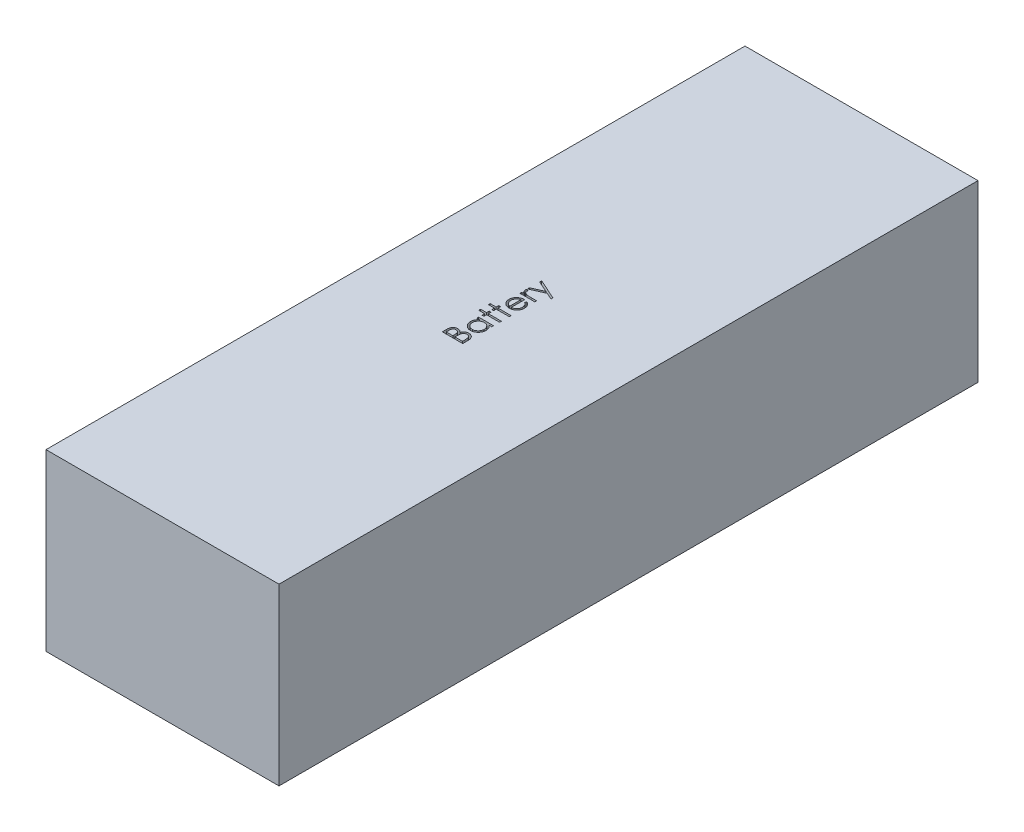
from build123d import *

# Parameters (mm, degrees)
SKETCH1_W           = 40
SKETCH1_H           = 120
BOSS_EXTRUDE1_DEPTH = 30
CUT_EXTRUDE1_DEPTH  = 2


with BuildPart() as part:
    # Sketch1 → Boss-Extrude1 (new body)
    with BuildSketch(Plane(origin=(0, 0, 0), x_dir=(1, 0, 0), z_dir=(0, 1, 0))):
        Rectangle(SKETCH1_W, SKETCH1_H)
    extrude(amount=BOSS_EXTRUDE1_DEPTH)

    # Sketch2 → Cut-Extrude1 (cut)
    # profile 1 of 7: a face of its own
    with BuildSketch(Plane(origin=(0, 30, 0), x_dir=(1, 0, 0), z_dir=(0, 1, 0))):
        with BuildLine():
            Line((-3.5, -8.458333333), (-3.5, -7.775440705))
            add(Edge.make_bspline(
                [(-3.5, -7.775440705), (-3.499827016, -7.7420117), (-3.499491731, -7.677217968), (-3.494170998, -7.58300569), (-3.487097587, -7.49473206), (-3.47523232, -7.412553068), (-3.462929603, -7.335933987), (-3.44487216, -7.265652662), (-3.424927056, -7.201120399), (-3.394238808, -7.12363036), (-3.346579571, -7.035707293), (-3.275896393, -6.941206448), (-3.191152971, -6.859060546), (-3.094581157, -6.789212181), (-2.988341218, -6.733157382), (-2.874718941, -6.693117247), (-2.755625884, -6.66739394), (-2.673976582, -6.664781715), (-2.63271234, -6.663461538)],
                knots=[0, 0, 0, 0, 1.00128172, 1.940733171, 2.826250472, 3.653024905, 4.427672124, 5.149348099, 5.824709082, 6.450061444, 7.643590664, 8.808605388, 9.972104426, 11.165284501, 12.367876273, 13.557044126, 14.765369432, 16, 16, 16, 16], degree=3))
            add(Edge.make_bspline(
                [(-2.63271234, -6.663461538), (-2.594061484, -6.664561149), (-2.518108906, -6.666721988), (-2.407211066, -6.687132958), (-2.301753702, -6.719528085), (-2.201827071, -6.764299458), (-2.109291316, -6.821984866), (-2.024433087, -6.891100094), (-1.950459558, -6.974141487), (-1.909119745, -7.036389596), (-1.888120994, -7.068008814)],
                knots=[0, 0, 0, 0, 1.044641374, 2.052818814, 3.038628718, 4.023282556, 5.005660861, 5.98021751, 6.974042014, 8, 8, 8, 8], degree=3))
            add(Edge.make_bspline(
                [(-1.888120994, -7.068008814), (-1.872851052, -7.028252226), (-1.84363587, -6.952188024), (-1.792064534, -6.847452202), (-1.73576949, -6.757544715), (-1.675242264, -6.680709266), (-1.609038135, -6.615342188), (-1.536619226, -6.558730519), (-1.458044822, -6.509788628), (-1.37360371, -6.468139417), (-1.284011735, -6.435423443), (-1.190363175, -6.411377655), (-1.093017032, -6.397154049), (-1.026955989, -6.395213731), (-0.993489583, -6.394230769)],
                knots=[0, 0, 0, 0, 1.272586185, 2.434772614, 3.483318042, 4.437947805, 5.351807173, 6.25737843, 7.180033415, 8.1141739, 9.066731021, 10.025721652, 10.999834114, 12, 12, 12, 12], degree=3))
            add(Edge.make_bspline(
                [(-0.993489583, -6.394230769), (-0.959322572, -6.395207402), (-0.89209802, -6.397128954), (-0.793344872, -6.411311975), (-0.698962627, -6.435309874), (-0.608384297, -6.468422258), (-0.521799795, -6.511341419), (-0.439522785, -6.564327526), (-0.361382093, -6.62663676), (-0.28723981, -6.697056266), (-0.21939729, -6.775533297), (-0.161075602, -6.862020036), (-0.110927262, -6.954147167), (-0.070098271, -7.053092449), (-0.038598733, -7.158603294), (-0.016652218, -7.270620992), (-0.001839877, -7.388961064), (-0.000623699, -7.47017141), (0, -7.51181891)],
                knots=[0, 0, 0, 0, 0.978680899, 1.925582087, 2.851223405, 3.764209995, 4.683484765, 5.614004905, 6.562443559, 7.542772147, 8.539900013, 9.527881485, 10.525548727, 11.540192123, 12.58875426, 13.674701727, 14.807505862, 16, 16, 16, 16], degree=3))
            Line((0, -7.51181891), (0, -8.458333333))
            Line((0, -8.458333333), (-3.5, -8.458333333))
        make_face()
        with BuildLine():
            Line((-3.141025641, -8.144230769), (-2.019230769, -8.144230769))
            Line((-2.019230769, -8.144230769), (-2.019230769, -7.933193109))
            add(Edge.make_bspline(
                [(-2.019230769, -7.933193109), (-2.019630692, -7.902344314), (-2.020403425, -7.842738154), (-2.022616943, -7.756418259), (-2.028814983, -7.676293237), (-2.035011254, -7.602501414), (-2.045085813, -7.535158937), (-2.05707803, -7.474415185), (-2.069760632, -7.419316235), (-2.091331398, -7.355778177), (-2.123200398, -7.283695136), (-2.172706503, -7.206901904), (-2.231625018, -7.138888088), (-2.300244736, -7.082142986), (-2.374983675, -7.035291432), (-2.455185698, -7.002470444), (-2.539236842, -6.980589669), (-2.597049479, -6.978582956), (-2.626402244, -6.977564103)],
                knots=[0, 0, 0, 0, 1.156917035, 2.235399477, 3.236897345, 4.169954739, 5.01148057, 5.788325709, 6.491867502, 7.129259015, 8.302032419, 9.437271567, 10.542795419, 11.662606952, 12.764338259, 13.836858145, 14.901724648, 16, 16, 16, 16], degree=3))
            add(Edge.make_bspline(
                [(-2.626402244, -6.977564103), (-2.645830562, -6.978081414), (-2.683941329, -6.979096176), (-2.739678522, -6.987708999), (-2.79205104, -7.001664059), (-2.841561526, -7.020562972), (-2.886979527, -7.046381692), (-2.930475233, -7.076308981), (-2.969443462, -7.113258467), (-3.005760298, -7.155014668), (-3.038263745, -7.202791209), (-3.065187813, -7.257617437), (-3.089589964, -7.31807601), (-3.107654151, -7.385807203), (-3.123538771, -7.459407601), (-3.133519185, -7.539873783), (-3.139941675, -7.626695849), (-3.14065626, -7.686852637), (-3.141025641, -7.717948718)],
                knots=[0, 0, 0, 0, 0.911708768, 1.788416306, 2.640049961, 3.452993646, 4.268229297, 5.087074648, 5.92553149, 6.781184137, 7.681934069, 8.628939405, 9.643570426, 10.73771997, 11.914765019, 13.176320755, 14.540391495, 16, 16, 16, 16], degree=3))
            Line((-3.141025641, -7.717948718), (-3.141025641, -8.144230769))
        make_face(mode=Mode.SUBTRACT)
        with BuildLine():
            Line((-1.66025641, -8.144230769), (-0.358974359, -8.144230769))
            Line((-0.358974359, -8.144230769), (-0.358974359, -7.696915064))
            add(Edge.make_bspline(
                [(-0.358974359, -7.696915064), (-0.359396264, -7.664899487), (-0.36020943, -7.603193683), (-0.362116473, -7.514030942), (-0.369330527, -7.431606517), (-0.375985459, -7.355660387), (-0.387365108, -7.286394114), (-0.398104538, -7.223274898), (-0.414046454, -7.167338884), (-0.435956742, -7.101880807), (-0.471032393, -7.028713806), (-0.522277589, -6.948755445), (-0.585522071, -6.879032992), (-0.657450692, -6.819182776), (-0.735443268, -6.769791778), (-0.818480193, -6.734349065), (-0.904946557, -6.712323699), (-0.963915826, -6.709666133), (-0.993489583, -6.708333333)],
                knots=[0, 0, 0, 0, 1.160376723, 2.23647316, 3.230273494, 4.158083346, 4.997711197, 5.773399541, 6.476071462, 7.102777513, 8.27340052, 9.405620712, 10.53304798, 11.669441455, 12.787990954, 13.865552736, 14.929550474, 16, 16, 16, 16], degree=3))
            add(Edge.make_bspline(
                [(-0.993489583, -6.708333333), (-1.011983322, -6.708608592), (-1.048672494, -6.70915467), (-1.102582506, -6.717427612), (-1.154829834, -6.729395938), (-1.205632199, -6.745158567), (-1.254135426, -6.767193873), (-1.300525527, -6.794207311), (-1.345737015, -6.82512899), (-1.403634242, -6.872835293), (-1.469513255, -6.943237626), (-1.533216158, -7.043287197), (-1.58542007, -7.156418988), (-1.60748965, -7.238664126), (-1.618890224, -7.28114984)],
                knots=[0, 0, 0, 0, 0.723302347, 1.434937762, 2.129609326, 2.821140842, 3.513216847, 4.209993937, 4.920569932, 5.655069131, 7.14393391, 8.6716197, 10.280644748, 12, 12, 12, 12], degree=3))
            add(Edge.make_bspline(
                [(-1.618890224, -7.28114984), (-1.622345308, -7.298178936), (-1.629836643, -7.335101528), (-1.637744346, -7.395309108), (-1.644789406, -7.464044977), (-1.650000564, -7.541467855), (-1.655387107, -7.627675696), (-1.657481929, -7.722852614), (-1.659981189, -7.826609929), (-1.660162323, -7.898602301), (-1.66025641, -7.935997596)],
                knots=[0, 0, 0, 0, 0.634451884, 1.375622551, 2.216452059, 3.157844607, 4.20941857, 5.370758133, 6.634282058, 8, 8, 8, 8], degree=3))
            Line((-1.66025641, -7.935997596), (-1.66025641, -8.144230769))
        make_face(mode=Mode.SUBTRACT)
    # profile 2 of 7: a face of its own
    with BuildSketch(Plane(origin=(0, 30, 0), x_dir=(1, 0, 0), z_dir=(0, 1, 0))):
        with BuildLine():
            Line((-2.557692308, -3.163461538), (0, -3.163461538))
            Line((0, -3.163461538), (0, -3.477564103))
            Line((0, -3.477564103), (-0.442407853, -3.477564103))
            add(Edge.make_bspline(
                [(-0.442407853, -3.477564103), (-0.402434233, -3.513038188), (-0.324309204, -3.582369261), (-0.22130842, -3.697074077), (-0.137906052, -3.820172648), (-0.069567916, -3.948576069), (-0.018442034, -4.083542085), (0.017961997, -4.22436527), (0.041350966, -4.371180164), (0.043687656, -4.471432036), (0.044871795, -4.522235577)],
                knots=[0, 0, 0, 0, 1.074325654, 2.099677833, 3.090439787, 4.057542011, 5.018572219, 5.985274637, 6.979019747, 8, 8, 8, 8], degree=3))
            add(Edge.make_bspline(
                [(0.044871795, -4.522235577), (0.043645423, -4.567403531), (0.041226962, -4.656476736), (0.022464659, -4.787505813), (-0.007665963, -4.913598062), (-0.049566853, -5.034872635), (-0.105147674, -5.15054478), (-0.171688922, -5.261604877), (-0.250929752, -5.367477569), (-0.341517781, -5.466549108), (-0.439912768, -5.557781108), (-0.544858315, -5.637842381), (-0.655900619, -5.704595461), (-0.771633773, -5.760415542), (-0.892948692, -5.803411886), (-1.01942586, -5.83338552), (-1.150915734, -5.852125967), (-1.240455257, -5.854543428), (-1.285857372, -5.855769231)],
                knots=[0, 0, 0, 0, 1.033919861, 2.038935746, 3.024066025, 3.998881131, 4.97069526, 5.957263378, 6.95902576, 7.993208707, 9.027059324, 10.027763471, 11.009749337, 11.988697705, 12.965288445, 13.950418724, 14.960734635, 16, 16, 16, 16], degree=3))
            add(Edge.make_bspline(
                [(-1.285857372, -5.855769231), (-1.330321075, -5.854516259), (-1.418223419, -5.852039203), (-1.547502117, -5.833585983), (-1.672020377, -5.802554974), (-1.791377321, -5.759007126), (-1.905717371, -5.703165171), (-2.015121396, -5.635237084), (-2.119890793, -5.55521796), (-2.21756202, -5.462965553), (-2.307782634, -5.363030783), (-2.38619168, -5.256122052), (-2.453908529, -5.14489877), (-2.507562005, -5.02763576), (-2.550971109, -4.906068655), (-2.581004078, -4.779115209), (-2.598701399, -4.647303631), (-2.601264163, -4.557813138), (-2.602564103, -4.512419872)],
                knots=[0, 0, 0, 0, 1.020392517, 2.01726096, 2.990465484, 3.961182959, 4.928053699, 5.906110375, 6.912531644, 7.948652711, 8.985773172, 9.998621852, 10.987621588, 11.969261332, 12.953316658, 13.946091881, 14.958173133, 16, 16, 16, 16], degree=3))
            add(Edge.make_bspline(
                [(-2.602564103, -4.512419872), (-2.60112475, -4.460221001), (-2.598302246, -4.35786148), (-2.574862161, -4.208119493), (-2.535141118, -4.066525993), (-2.481482841, -3.931577829), (-2.408686533, -3.805132528), (-2.319426341, -3.685616034), (-2.210011935, -3.575571068), (-2.127018146, -3.510798221), (-2.084435096, -3.477564103)],
                knots=[0, 0, 0, 0, 1.039007978, 2.037445607, 3.008437381, 3.96246474, 4.921201921, 5.904967172, 6.925065498, 8, 8, 8, 8], degree=3))
            Line((-2.084435096, -3.477564103), (-2.557692308, -3.477564103))
            Line((-2.557692308, -3.477564103), (-2.557692308, -3.163461538))
        make_face()
        with BuildLine():
            add(Edge.make_bspline(
                [(-2.288461538, -4.508213141), (-2.286826503, -4.554126491), (-2.283599202, -4.64475214), (-2.258445926, -4.777810432), (-2.216485352, -4.905070149), (-2.159435035, -5.026333401), (-2.086337296, -5.138218684), (-2.000214663, -5.239968121), (-1.899613419, -5.328444379), (-1.788133794, -5.404533748), (-1.667961498, -5.465616495), (-1.542380577, -5.508840764), (-1.413564365, -5.537295235), (-1.326203179, -5.540205729), (-1.282351763, -5.541666667)],
                knots=[0, 0, 0, 0, 1.031130969, 2.035288524, 3.029955243, 4.035265425, 5.037320146, 6.024362013, 7.021230137, 8.037832003, 9.049975902, 10.039737725, 11.016035826, 12, 12, 12, 12], degree=3))
            add(Edge.make_bspline(
                [(-1.282351763, -5.541666667), (-1.238764409, -5.539794247), (-1.151760548, -5.536056748), (-1.022955393, -5.509463754), (-0.897656365, -5.46426423), (-0.776518381, -5.40326408), (-0.663949475, -5.326279197), (-0.561541317, -5.237887085), (-0.474071536, -5.135648106), (-0.400797577, -5.022762497), (-0.341644806, -4.902143299), (-0.300476607, -4.775312314), (-0.273899498, -4.644635904), (-0.27079493, -4.555783674), (-0.269230769, -4.511017628)],
                knots=[0, 0, 0, 0, 0.979154007, 1.954470061, 2.941101473, 3.965068436, 4.993389179, 5.998216918, 6.996159742, 8.005560442, 9.015493761, 10.005250788, 10.994993882, 12, 12, 12, 12], degree=3))
            add(Edge.make_bspline(
                [(-0.269230769, -4.511017628), (-0.27090991, -4.465577318), (-0.274249554, -4.375201047), (-0.299260521, -4.24159942), (-0.342149827, -4.112389458), (-0.399788619, -3.988452577), (-0.471579217, -3.873107804), (-0.555626614, -3.769935177), (-0.652700961, -3.681663055), (-0.760626239, -3.608170055), (-0.878190217, -3.549886515), (-1.00322951, -3.507270335), (-1.135997919, -3.482353785), (-1.226858223, -3.479182739), (-1.273237179, -3.477564103)],
                knots=[0, 0, 0, 0, 1.01787422, 2.024450869, 3.03297362, 4.061474925, 5.080076323, 6.069755756, 7.033548292, 8.009625779, 8.9862229, 9.964937832, 10.961217871, 12, 12, 12, 12], degree=3))
            add(Edge.make_bspline(
                [(-1.273237179, -3.477564103), (-1.30857501, -3.478523759), (-1.378131043, -3.480412666), (-1.480258561, -3.494843236), (-1.577992287, -3.517798162), (-1.671434976, -3.550144332), (-1.760069991, -3.592635617), (-1.844533752, -3.643883383), (-1.924386963, -3.704788832), (-1.998530034, -3.774371528), (-2.066156496, -3.850536731), (-2.126520737, -3.931131272), (-2.17610951, -4.017110019), (-2.217150781, -4.107027056), (-2.249809931, -4.20103839), (-2.271597625, -4.29990901), (-2.286557946, -4.402587997), (-2.287820327, -4.472634052), (-2.288461538, -4.508213141)],
                knots=[0, 0, 0, 0, 1.050140795, 2.067009409, 3.05949893, 4.030605086, 5.00011959, 5.97591094, 6.962425594, 7.979863591, 8.993523472, 9.986985069, 10.967611495, 11.937549037, 12.921786183, 13.919465291, 14.943216303, 16, 16, 16, 16], degree=3))
        make_face(mode=Mode.SUBTRACT)
    # profile 3 of 7: a face of its own
    with BuildSketch(Plane(origin=(0, 30, 0), x_dir=(1, 0, 0), z_dir=(0, 1, 0))):
        Polygon((-3.58974359, -2.131410256), (-3.58974359, -1.817307692), (-2.557692308, -1.817307692), (-2.557692308, -1.368589744), (-2.243589744, -1.368589744), (-2.243589744, -1.817307692), (0, -1.817307692), (0, -2.131410256), (-2.243589744, -2.131410256), (-2.243589744, -2.580128205), (-2.557692308, -2.580128205), (-2.557692308, -2.131410256), align=None)
    # profile 4 of 7: a face of its own
    with BuildSketch(Plane(origin=(0, 30, 0), x_dir=(1, 0, 0), z_dir=(0, 1, 0))):
        Polygon((-3.58974359, -0.471153846), (-3.58974359, -0.157051282), (-2.557692308, -0.157051282), (-2.557692308, 0.291666667), (-2.243589744, 0.291666667), (-2.243589744, -0.157051282), (0, -0.157051282), (0, -0.471153846), (-2.243589744, -0.471153846), (-2.243589744, -0.919871795), (-2.557692308, -0.919871795), (-2.557692308, -0.471153846), align=None)
    # profile 5 of 7: a face of its own
    with BuildSketch(Plane(origin=(0, 30, 0), x_dir=(1, 0, 0), z_dir=(0, 1, 0))):
        with BuildLine():
            Line((-0.807692308, 2.974158654), (-0.661157853, 3.253205128))
            add(Edge.make_bspline(
                [(-0.661157853, 3.253205128), (-0.621723871, 3.230956867), (-0.54500096, 3.187670562), (-0.439586991, 3.113533639), (-0.345319457, 3.035105172), (-0.26370785, 2.949998894), (-0.191634668, 2.860779417), (-0.129467518, 2.765752187), (-0.07608468, 2.665692851), (-0.032342426, 2.559499307), (0.002045853, 2.447298764), (0.027441832, 2.328440154), (0.042169086, 2.202362272), (0.043956532, 2.116024309), (0.044871795, 2.071814904)],
                knots=[0, 0, 0, 0, 1.120611642, 2.180266485, 3.186550691, 4.152466804, 5.095166165, 6.022949561, 6.960161436, 7.899497276, 8.862391909, 9.862399089, 10.905440174, 12, 12, 12, 12], degree=3))
            add(Edge.make_bspline(
                [(0.044871795, 2.071814904), (0.04372462, 2.022672926), (0.041486813, 1.926811165), (0.022194349, 1.787271417), (-0.009278012, 1.655892002), (-0.053243547, 1.532680284), (-0.110670893, 1.417938085), (-0.180630295, 1.311437034), (-0.26276285, 1.21261825), (-0.357778154, 1.124591225), (-0.459464338, 1.045357789), (-0.565404947, 0.975394209), (-0.675233097, 0.91717448), (-0.788295336, 0.8690925), (-0.90433474, 0.83116493), (-1.024015882, 0.804213014), (-1.146864189, 0.788819865), (-1.229959798, 0.786450451), (-1.271834936, 0.78525641)],
                knots=[0, 0, 0, 0, 1.14524686, 2.234044844, 3.276713788, 4.290115724, 5.276966211, 6.260758605, 7.254862358, 8.264742877, 9.274005885, 10.257798278, 11.220590477, 12.167824544, 13.118936889, 14.062732937, 15.023735098, 16, 16, 16, 16], degree=3))
            add(Edge.make_bspline(
                [(-1.271834936, 0.78525641), (-1.311129766, 0.786315552), (-1.389006931, 0.78841463), (-1.504272476, 0.801645417), (-1.616300928, 0.82509371), (-1.725185376, 0.857270034), (-1.83074351, 0.89882128), (-1.933039574, 0.9496535), (-2.031964713, 1.009845877), (-2.094367847, 1.056318551), (-2.125801282, 1.079727564)],
                knots=[0, 0, 0, 0, 1.024358464, 2.0301432, 3.019427413, 4.004406732, 4.986367066, 5.972626655, 6.978780325, 8, 8, 8, 8], degree=3))
            add(Edge.make_bspline(
                [(-2.125801282, 1.079727564), (-2.163732941, 1.111380583), (-2.238272838, 1.17358226), (-2.335322662, 1.279879021), (-2.418340489, 1.393428801), (-2.486066597, 1.515373775), (-2.538158683, 1.645508534), (-2.575211094, 1.783161852), (-2.598266796, 1.9287142), (-2.601109889, 2.028491927), (-2.602564103, 2.079527244)],
                knots=[0, 0, 0, 0, 1.030811313, 2.025658015, 2.997072178, 3.962767568, 4.930766827, 5.917075773, 6.934604948, 8, 8, 8, 8], degree=3))
            add(Edge.make_bspline(
                [(-2.602564103, 2.079527244), (-2.601216835, 2.131977865), (-2.598573804, 2.234874027), (-2.573851652, 2.384863538), (-2.535122917, 2.527065444), (-2.478696987, 2.660306226), (-2.408753193, 2.786638927), (-2.320347513, 2.903156015), (-2.218020567, 3.01305596), (-2.13924476, 3.076957845), (-2.099158654, 3.10947516)],
                knots=[0, 0, 0, 0, 1.056389096, 2.072394598, 3.055233004, 4.020130009, 4.981825462, 5.957811105, 6.960805292, 8, 8, 8, 8], degree=3))
            add(Edge.make_bspline(
                [(-2.099158654, 3.10947516), (-2.068955072, 3.131602099), (-2.008748954, 3.175708692), (-1.910577797, 3.230955792), (-1.807867202, 3.278913187), (-1.698956905, 3.317246148), (-1.585137325, 3.348285649), (-1.46559478, 3.370742468), (-1.340364869, 3.383912086), (-1.255038314, 3.386500784), (-1.211538462, 3.387820513)],
                knots=[0, 0, 0, 0, 0.94817472, 1.890038105, 2.849395472, 3.817997239, 4.812318967, 5.836947057, 6.897266129, 8, 8, 8, 8], degree=3))
            Line((-1.211538462, 3.387820513), (-1.211538462, 1.099358974))
            add(Edge.make_bspline(
                [(-1.211538462, 1.099358974), (-1.177837997, 1.100898581), (-1.111567394, 1.103926155), (-1.01459661, 1.118041298), (-0.922223268, 1.140290072), (-0.835140226, 1.171559134), (-0.752210099, 1.20942598), (-0.674048062, 1.255811696), (-0.601010132, 1.31115125), (-0.532442994, 1.37287695), (-0.471382233, 1.441584045), (-0.416730457, 1.513866792), (-0.37092486, 1.590760357), (-0.33374497, 1.671658441), (-0.304638654, 1.756430226), (-0.284770834, 1.845102421), (-0.271463727, 1.937500537), (-0.269984061, 2.000486271), (-0.269230769, 2.032552083)],
                knots=[0, 0, 0, 0, 1.094153842, 2.151609401, 3.174256925, 4.172055639, 5.149267565, 6.128595816, 7.11444997, 8.118368179, 9.117203808, 10.09244225, 11.054858984, 12.015122123, 12.976791628, 13.957293641, 14.960065497, 16, 16, 16, 16], degree=3))
            add(Edge.make_bspline(
                [(-0.269230769, 2.032552083), (-0.269833929, 2.063904599), (-0.271030715, 2.126114004), (-0.282834755, 2.218734711), (-0.301543133, 2.310015531), (-0.328488888, 2.399050071), (-0.360042003, 2.484540764), (-0.397179816, 2.564147182), (-0.439521127, 2.636816889), (-0.487636723, 2.705001224), (-0.546687196, 2.770778631), (-0.61966842, 2.837063141), (-0.707408148, 2.906568865), (-0.773006325, 2.950780902), (-0.807692308, 2.974158654)],
                knots=[0, 0, 0, 0, 0.991168677, 1.966668791, 2.94808785, 3.9350306, 4.905702032, 5.828266021, 6.709360349, 7.562606342, 8.463112863, 9.498839253, 10.677475166, 12, 12, 12, 12], degree=3))
        make_face()
        with BuildLine():
            add(Edge.make_bspline(
                [(-1.525641026, 3.073717949), (-1.567324719, 3.062267881), (-1.647343869, 3.04028747), (-1.75811233, 2.993476365), (-1.857124106, 2.942028316), (-1.942733842, 2.880094988), (-2.018888471, 2.81060817), (-2.084375044, 2.729237427), (-2.144732764, 2.6395119), (-2.194996376, 2.539644438), (-2.236300966, 2.433573316), (-2.266672607, 2.323478716), (-2.284525968, 2.210282779), (-2.287143515, 2.134042572), (-2.288461538, 2.095653045)],
                knots=[0, 0, 0, 0, 1.155085888, 2.217389643, 3.210301801, 4.133263417, 5.03575695, 5.95948047, 6.920061569, 7.923798377, 8.943125483, 9.960783337, 10.973185325, 12, 12, 12, 12], degree=3))
            add(Edge.make_bspline(
                [(-2.288461538, 2.095653045), (-2.287857, 2.064301211), (-2.286661954, 2.002325226), (-2.275088768, 1.91105877), (-2.256491944, 1.823183438), (-2.229148178, 1.738961532), (-2.195876219, 1.657834378), (-2.154978249, 1.579860597), (-2.105531888, 1.506042557), (-2.067760071, 1.459906385), (-2.048677885, 1.436598558)],
                knots=[0, 0, 0, 0, 1.048823158, 2.073302879, 3.073550078, 4.050623576, 5.03253758, 6.005186856, 6.992227572, 8, 8, 8, 8], degree=3))
            add(Edge.make_bspline(
                [(-2.048677885, 1.436598558), (-2.033585155, 1.41990266), (-2.00304115, 1.386114231), (-1.950387182, 1.341014543), (-1.893576633, 1.297511153), (-1.83012967, 1.258852052), (-1.761886187, 1.222112316), (-1.688348228, 1.18863289), (-1.609205387, 1.158191846), (-1.554028674, 1.141103443), (-1.525641026, 1.132311699)],
                knots=[0, 0, 0, 0, 0.879905587, 1.780714457, 2.708106151, 3.677566983, 4.684151534, 5.740052498, 6.837288539, 8, 8, 8, 8], degree=3))
            Line((-1.525641026, 1.132311699), (-1.525641026, 3.073717949))
        make_face(mode=Mode.SUBTRACT)
    # profile 6 of 7: a face of its own
    with BuildSketch(Plane(origin=(0, 30, 0), x_dir=(1, 0, 0), z_dir=(0, 1, 0))):
        with BuildLine():
            Line((-2.557692308, 3.926282051), (-2.557692308, 4.240384615))
            Line((-2.557692308, 4.240384615), (-2.181189904, 4.240384615))
            add(Edge.make_bspline(
                [(-2.181189904, 4.240384615), (-2.216261426, 4.263558537), (-2.283335439, 4.307878482), (-2.371926058, 4.3818883), (-2.446113212, 4.456887874), (-2.504482141, 4.534846555), (-2.548594798, 4.61500002), (-2.57959138, 4.696672377), (-2.598813304, 4.780063344), (-2.601312162, 4.836238806), (-2.602564103, 4.864383013)],
                knots=[0, 0, 0, 0, 1.280091057, 2.448164201, 3.510831157, 4.48793739, 5.405868014, 6.289422536, 7.142991551, 8, 8, 8, 8], degree=3))
            add(Edge.make_bspline(
                [(-2.602564103, 4.864383013), (-2.601373576, 4.886209339), (-2.59892399, 4.931118425), (-2.581713165, 4.999101014), (-2.554235143, 5.069144466), (-2.52839492, 5.114286853), (-2.514923878, 5.137820513)],
                knots=[0, 0, 0, 0, 0.901110191, 1.854092781, 2.881294221, 4, 4, 4, 4], degree=3))
            Line((-2.514923878, 5.137820513), (-2.242888622, 4.965344551))
            add(Edge.make_bspline(
                [(-2.242888622, 4.965344551), (-2.249628888, 4.95023553), (-2.262423203, 4.921555716), (-2.277565213, 4.879601149), (-2.286481129, 4.840919813), (-2.287831847, 4.816276254), (-2.288461538, 4.80478766)],
                knots=[0, 0, 0, 0, 1.180555205, 2.24091978, 3.179933427, 4, 4, 4, 4], degree=3))
            add(Edge.make_bspline(
                [(-2.288461538, 4.80478766), (-2.286794658, 4.779574359), (-2.283394705, 4.728146533), (-2.256284039, 4.652895199), (-2.213741221, 4.579219825), (-2.165297528, 4.521271591), (-2.118763125, 4.476244726), (-2.078035261, 4.443862548), (-2.031944456, 4.414799061), (-1.982272224, 4.386606707), (-1.927771932, 4.360413881), (-1.868354671, 4.337006744), (-1.804511084, 4.315116564), (-1.76011915, 4.302789023), (-1.737379808, 4.296474359)],
                knots=[0, 0, 0, 0, 1.125322384, 2.295331465, 3.535939348, 4.916963136, 5.656144286, 6.429838446, 7.238666481, 8.090384391, 8.983239461, 9.940052224, 10.944811494, 12, 12, 12, 12], degree=3))
            add(Edge.make_bspline(
                [(-1.737379808, 4.296474359), (-1.717103757, 4.291733787), (-1.671968634, 4.281181125), (-1.596591234, 4.271194733), (-1.507592607, 4.260930349), (-1.404869363, 4.253920809), (-1.288026631, 4.247299363), (-1.157568472, 4.243641403), (-1.013136318, 4.240500999), (-0.912395458, 4.240424648), (-0.859575321, 4.240384615)],
                knots=[0, 0, 0, 0, 0.566841273, 1.261806378, 2.068780918, 3.007109044, 4.065315289, 5.256255371, 6.561408263, 8, 8, 8, 8], degree=3))
            Line((-0.859575321, 4.240384615), (0, 4.240384615))
            Line((0, 4.240384615), (0, 3.926282051))
            Line((0, 3.926282051), (-2.557692308, 3.926282051))
        make_face()
    # profile 7 of 7: a face of its own
    with BuildSketch(Plane(origin=(0, 30, 0), x_dir=(1, 0, 0), z_dir=(0, 1, 0))):
        Polygon((-2.557692308, 5.227564103), (-2.557692308, 5.566205929), (-0.598758013, 6.432091346), (-2.557692308, 7.311298077), (-2.557692308, 7.650641026), (0.942307692, 6.080128205), (0.942307692, 5.740785256), (-0.218048878, 6.26171875), align=None)
    extrude(amount=-CUT_EXTRUDE1_DEPTH, mode=Mode.SUBTRACT)


solid = part.part
